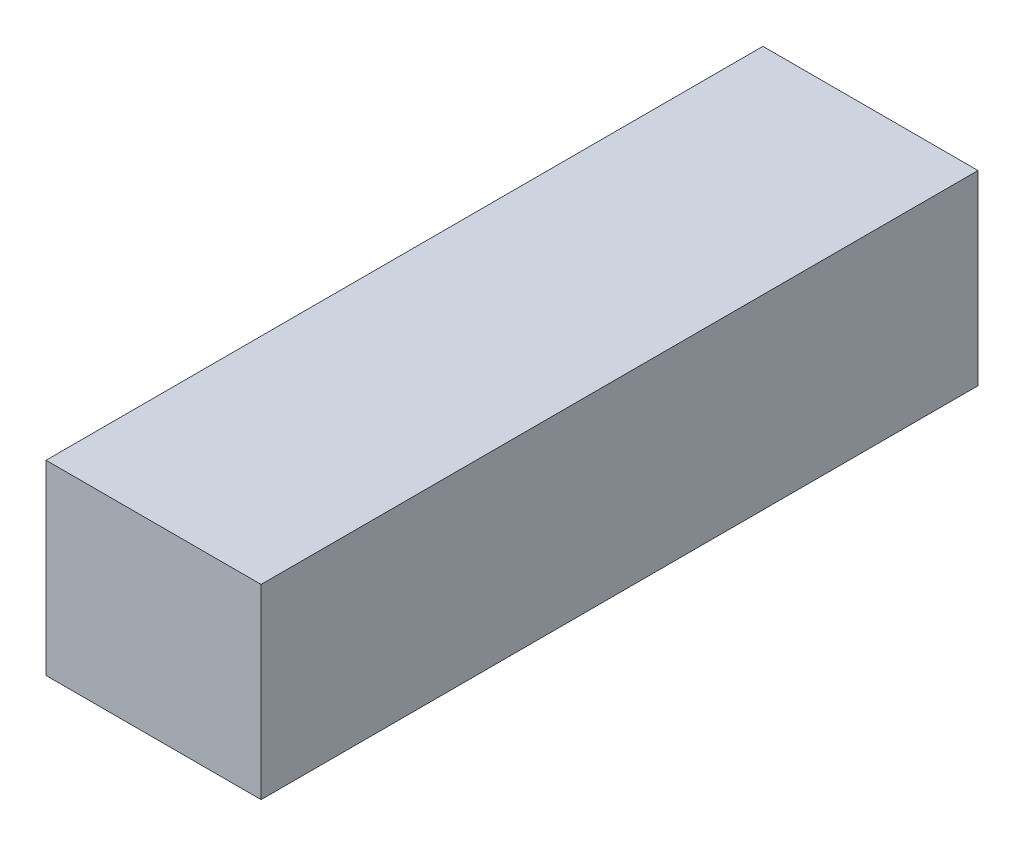
from build123d import *

# Parameters (mm, degrees)
SKETCH1_W           = 30
SKETCH1_H           = 100
BOSS_EXTRUDE1_DEPTH = 26


with BuildPart() as part:
    # Sketch1 → Boss-Extrude1 (new body)
    with BuildSketch(Plane(origin=(0, 0, 0), x_dir=(1, 0, 0), z_dir=(0, 1, 0))):
        with Locations((15, 50)):
            Rectangle(SKETCH1_W, SKETCH1_H)
    extrude(amount=BOSS_EXTRUDE1_DEPTH)


solid = part.part
